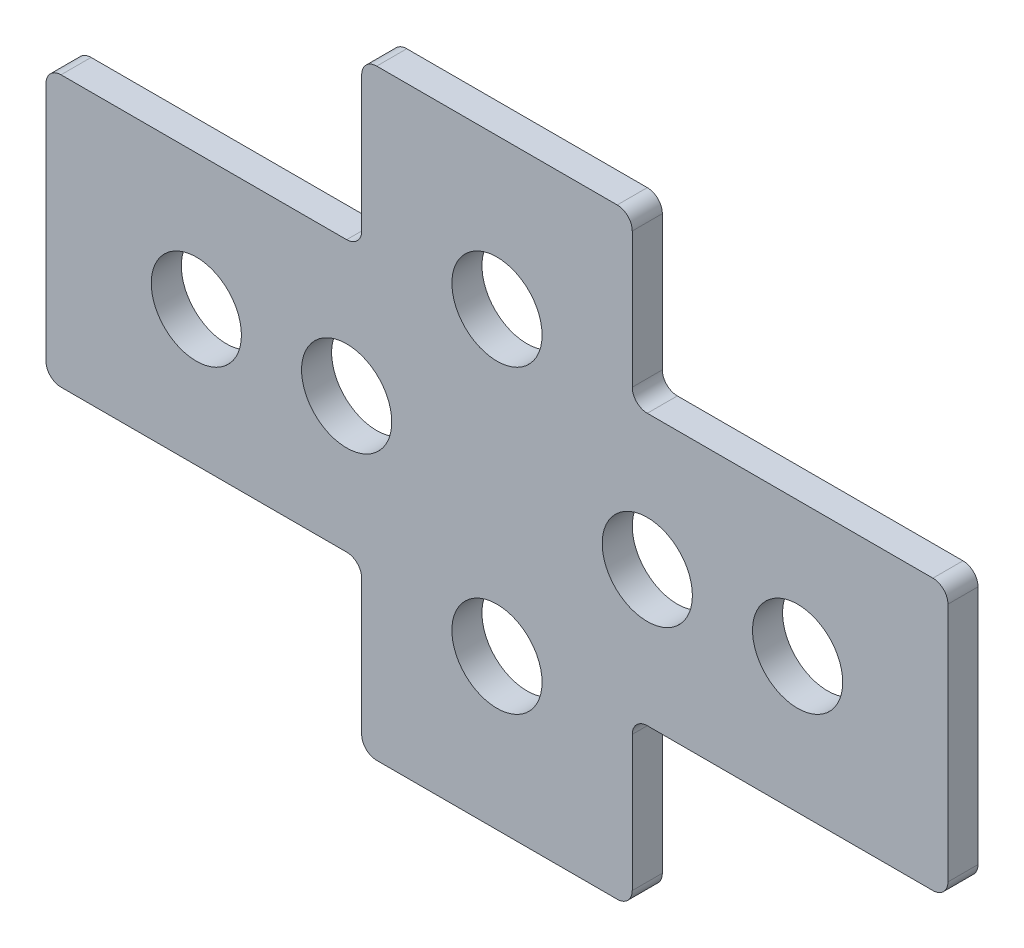
from build123d import *

# Parameters (mm, degrees)
SKETCH_1_R      = 3
EXTRUDE_1_DEPTH = 2


with BuildPart() as part:
    # 草图1 → 凸台-拉伸1 (new body)
    with BuildSketch(Plane.XY):
        with BuildLine():
            Line((-9, -9), (-9, 0))
            ThreePointArc((-9, 0), (-9.292893219, 0.707106781), (-10, 1))
            Line((-10, 1), (-29, 1))
            ThreePointArc((-29, 1), (-29.707106781, 1.292893219), (-30, 2))
            Line((-30, 2), (-30, 18))
            ThreePointArc((-30, 18), (-29.707106781, 18.707106781), (-29, 19))
            Line((-29, 19), (-10, 19))
            ThreePointArc((-10, 19), (-9.292893219, 19.292893219), (-9, 20))
            Line((-9, 20), (-9, 29))
            ThreePointArc((-9, 29), (-8.707106781, 29.707106781), (-8, 30))
            Line((-8, 30), (8, 30))
            ThreePointArc((8, 30), (8.707106781, 29.707106781), (9, 29))
            Line((9, 29), (9, 20))
            ThreePointArc((9, 20), (9.292893219, 19.292893219), (10, 19))
            Line((10, 19), (29, 19))
            ThreePointArc((29, 19), (29.707106781, 18.707106781), (30, 18))
            Line((30, 18), (30, 2))
            ThreePointArc((30, 2), (29.707106781, 1.292893219), (29, 1))
            Line((29, 1), (10, 1))
            ThreePointArc((10, 1), (9.292893219, 0.707106781), (9, 0))
            Line((9, 0), (9, -9))
            ThreePointArc((9, -9), (8.707106781, -9.707106781), (8, -10))
            Line((8, -10), (-8, -10))
            ThreePointArc((-8, -10), (-8.707106781, -9.707106781), (-9, -9))
        make_face()
        with Locations((0, 20)):
            Circle(SKETCH_1_R, mode=Mode.SUBTRACT)
        Circle(SKETCH_1_R, mode=Mode.SUBTRACT)
        with Locations((-20, 10)):
            Circle(SKETCH_1_R, mode=Mode.SUBTRACT)
        with Locations((-10, 10)):
            Circle(SKETCH_1_R, mode=Mode.SUBTRACT)
        with Locations((20, 10)):
            Circle(SKETCH_1_R, mode=Mode.SUBTRACT)
        with Locations((10, 10)):
            Circle(SKETCH_1_R, mode=Mode.SUBTRACT)
    extrude(amount=EXTRUDE_1_DEPTH)


solid = part.part
